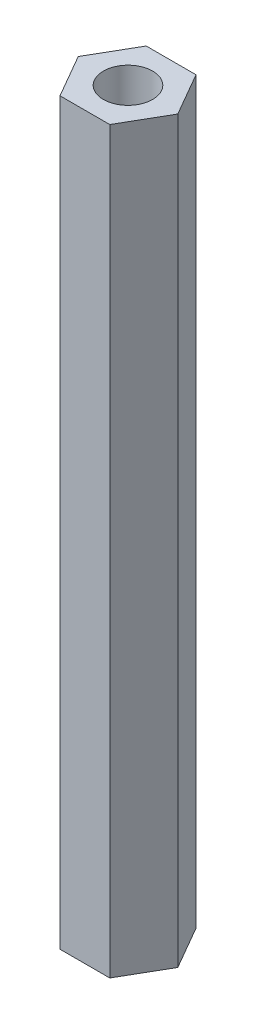
from build123d import *

# Parameters (mm, degrees)
SKETCH_1_R      = 2
EXTRUDE_1_DEPTH = 60


with BuildPart() as part:
    # 草图1 → 凸台-拉伸1 (new body)
    with BuildSketch(Plane(origin=(0, 0, 0), x_dir=(1, 0, 0), z_dir=(0, 1, 0))):
        Polygon((4.041451884, 0), (2.020725942, 3.5), (-2.020725942, 3.5), (-4.041451884, 0), (-2.020725942, -3.5), (2.020725942, -3.5), align=None)
        with Locations(Location((0, 0, 0), (0, 0, 270))):
            Circle(SKETCH_1_R, mode=Mode.SUBTRACT)
    extrude(amount=EXTRUDE_1_DEPTH)


solid = part.part
